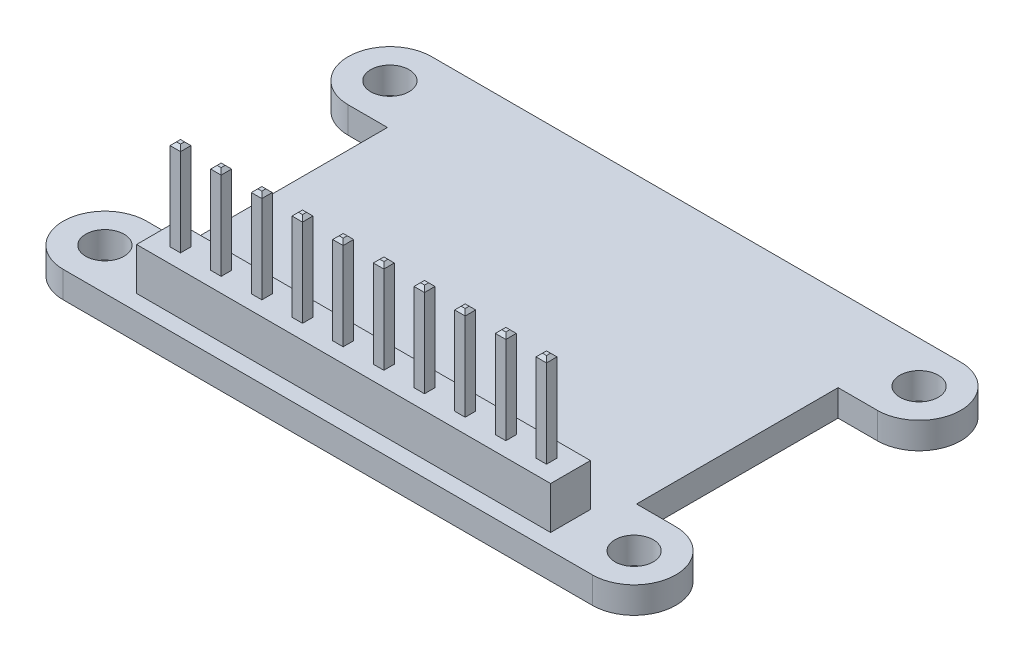
from build123d import *

# Parameters (mm, degrees)
SKETCH1_R           = 1.19
BOSS_EXTRUDE1_DEPTH = 1.64
SKETCH2_W           = 25.68
SKETCH2_H           = 2.47
BOSS_EXTRUDE2_DEPTH = 2.63
SKETCH3_W           = 0.65
SKETCH3_H           = 0.65
BOSS_EXTRUDE3_DEPTH = 5.64
CHAMFER1_SIZE       = 0.2


with BuildPart() as part:
    # Sketch1 → Boss-Extrude1 (new body)
    with BuildSketch(Plane(origin=(0, 0, 0), x_dir=(1, 0, 0), z_dir=(0, 1, 0))):
        with BuildLine():
            Line((-16.4125, 0), (16.4125, 0))
            ThreePointArc((16.4125, 0), (19, 2.5875), (16.4125, 5.175))
            Line((16.4125, 5.175), (13.975, 5.175))
            Line((13.975, 5.175), (13.975, 17.675))
            Line((13.975, 17.675), (16.4125, 17.675))
            ThreePointArc((16.4125, 17.675), (19, 20.2625), (16.4125, 22.85))
            Line((16.4125, 22.85), (-16.4125, 22.85))
            ThreePointArc((-16.4125, 22.85), (-19, 20.2625), (-16.4125, 17.675))
            Line((-16.4125, 17.675), (-13.975, 17.675))
            Line((-13.975, 17.675), (-13.975, 5.175))
            Line((-13.975, 5.175), (-16.4125, 5.175))
            ThreePointArc((-16.4125, 5.175), (-19, 2.5875), (-16.4125, 0))
        make_face()
        with Locations(Location((16.4125, 20.2625, 0), (0, 0, 270))):
            Circle(SKETCH1_R, mode=Mode.SUBTRACT)
        with Locations(Location((-16.4125, 20.2625, 0), (0, 0, 270))):
            Circle(SKETCH1_R, mode=Mode.SUBTRACT)
        with Locations(Location((-16.4125, 2.5875, 0), (0, 0, 270))):
            Circle(SKETCH1_R, mode=Mode.SUBTRACT)
        with Locations(Location((16.4125, 2.5875, 0), (0, 0, 270))):
            Circle(SKETCH1_R, mode=Mode.SUBTRACT)
    extrude(amount=BOSS_EXTRUDE1_DEPTH)

    # Sketch2 → Boss-Extrude2 (add)
    with BuildSketch(Plane(origin=(0, 1.64, 0), x_dir=(1, 0, 0), z_dir=(0, 1, 0))):
        with Locations((0, 2.215)):
            Rectangle(SKETCH2_W, SKETCH2_H)
    extrude(amount=BOSS_EXTRUDE2_DEPTH)

    # Sketch3 → Boss-Extrude3 (add)
    with BuildSketch(Plane(origin=(0, 4.27, 0), x_dir=(1, 0, 0), z_dir=(0, 1, 0))):
        with Locations((11.35, 2.215)):
            Rectangle(SKETCH3_W, SKETCH3_H)
        with Locations((8.827777778, 2.215)):
            Rectangle(SKETCH3_W, SKETCH3_H)
        with Locations((6.305555556, 2.215)):
            Rectangle(SKETCH3_W, SKETCH3_H)
        with Locations((3.783333333, 2.215)):
            Rectangle(SKETCH3_W, SKETCH3_H)
        with Locations((1.261111111, 2.215)):
            Rectangle(SKETCH3_W, SKETCH3_H)
        with Locations((-1.261111111, 2.215)):
            Rectangle(SKETCH3_W, SKETCH3_H)
        with Locations((-3.783333333, 2.215)):
            Rectangle(SKETCH3_W, SKETCH3_H)
        with Locations((-6.305555556, 2.215)):
            Rectangle(SKETCH3_W, SKETCH3_H)
        with Locations((-8.827777778, 2.215)):
            Rectangle(SKETCH3_W, SKETCH3_H)
        with Locations((-11.35, 2.215)):
            Rectangle(SKETCH3_W, SKETCH3_H)
    extrude(amount=BOSS_EXTRUDE3_DEPTH)

    # Chamfer1
    chamfer1_edges = [part.edges().sort_by_distance(p)[0] for p in [
        (3.783333333, 9.91, -1.89),
        (4.108333333, 9.91, -2.215),
        (1.261111111, 9.91, -2.54),
        (0.936111111, 9.91, -2.215),
        (1.261111111, 9.91, -1.89),
        (1.586111111, 9.91, -2.215),
        (-1.261111111, 9.91, -2.54),
        (-1.586111111, 9.91, -2.215),
        (-1.261111111, 9.91, -1.89),
        (-0.936111111, 9.91, -2.215),
        (-3.783333333, 9.91, -2.54),
        (-4.108333333, 9.91, -2.215),
        (-3.783333333, 9.91, -1.89),
        (-3.458333333, 9.91, -2.215),
        (-6.305555556, 9.91, -2.54),
        (-6.630555556, 9.91, -2.215),
        (-6.305555556, 9.91, -1.89),
        (-5.980555556, 9.91, -2.215),
        (-8.827777778, 9.91, -2.54),
        (-9.152777778, 9.91, -2.215),
        (-8.827777778, 9.91, -1.89),
        (-8.502777778, 9.91, -2.215),
        (-11.35, 9.91, -2.54),
        (-11.675, 9.91, -2.215),
        (-11.35, 9.91, -1.89),
        (-11.025, 9.91, -2.215),
        (11.675, 9.91, -2.215),
        (11.35, 9.91, -2.54),
        (11.025, 9.91, -2.215),
        (11.35, 9.91, -1.89),
        (8.827777778, 9.91, -2.54),
        (8.502777778, 9.91, -2.215),
        (8.827777778, 9.91, -1.89),
        (9.152777778, 9.91, -2.215),
        (6.305555556, 9.91, -2.54),
        (5.980555556, 9.91, -2.215),
        (6.305555556, 9.91, -1.89),
        (6.630555556, 9.91, -2.215),
        (3.783333333, 9.91, -2.54),
        (3.458333333, 9.91, -2.215),
    ]]
    chamfer(chamfer1_edges, length=CHAMFER1_SIZE)


solid = part.part
